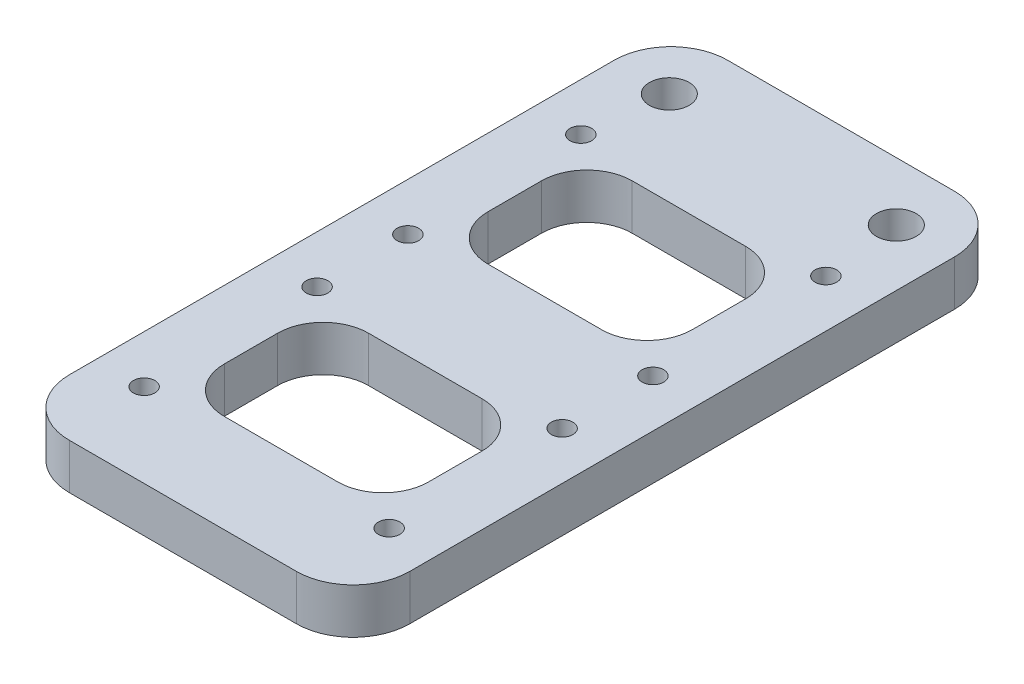
from build123d import *

# Parameters (mm, degrees)
SKETCH1_W           = 30
SKETCH1_H           = 30
BOSS_EXTRUDE1_DEPTH = 4
SKETCH3_W           = 30
SKETCH3_H           = 28
BOSS_EXTRUDE2_DEPTH = 4
SKETCH2_R           = 0.95
SKETCH2_R_2         = 1.75
CUT_EXTRUDE1_DEPTH  = 46.716517803
FILLET1_R           = 5


with BuildPart() as part:
    # Sketch1 → Boss-Extrude1 (new body)
    with BuildSketch(Plane(origin=(0, 0, 0), x_dir=(1, 0, 0), z_dir=(0, 1, 0))):
        Rectangle(SKETCH1_W, SKETCH1_H)
    extrude(amount=BOSS_EXTRUDE1_DEPTH)

    # Sketch3 → Boss-Extrude2 (add)
    with BuildSketch(Plane(origin=(0, 4, 0), x_dir=(1, 0, 0), z_dir=(0, 1, 0))):
        with Locations((0, 29)):
            Rectangle(SKETCH3_W, SKETCH3_H)
    extrude(amount=-BOSS_EXTRUDE2_DEPTH)

    # Sketch2 → Cut-Extrude1 (cut, through all)
    with BuildSketch(Plane(origin=(0, 4, 0), x_dir=(1, 0, 0), z_dir=(0, 1, 0))):
        with Locations(Location((-10.795, -7.62, 0), (0, 0, 270))):
            Circle(SKETCH2_R)
        with Locations(Location((10.795, -7.62, 0), (0, 0, 270))):
            Circle(SKETCH2_R)
        with Locations(Location((10.795, 7.62, 0), (0, 0, 270))):
            Circle(SKETCH2_R)
        with Locations(Location((-10.795, 7.62, 0), (0, 0, 270))):
            Circle(SKETCH2_R)
        with Locations(Location((-10.795, 30.86, 0), (0, 0, 270))):
            Circle(SKETCH2_R)
        with Locations(Location((10.795, 30.86, 0), (0, 0, 270))):
            Circle(SKETCH2_R)
        with Locations(Location((10.795, 15.62, 0), (0, 0, 270))):
            Circle(SKETCH2_R)
        with Locations(Location((-10.795, 15.62, 0), (0, 0, 270))):
            Circle(SKETCH2_R)
        with Locations(Location((-10, 37.86, 0), (0, 0, 270))):
            Circle(SKETCH2_R_2)
        with Locations(Location((10, 37.86, 0), (0, 0, 270))):
            Circle(SKETCH2_R_2)
        with BuildLine():
            Line((-5, -6.352941176), (5, -6.352941176))
            ThreePointArc((5, -6.352941176), (7.828427125, -5.181368301), (9, -2.352941176))
            Line((9, -2.352941176), (9, 2.352941176))
            ThreePointArc((9, 2.352941176), (7.828427125, 5.181368301), (5, 6.352941176))
            Line((5, 6.352941176), (-5, 6.352941176))
            ThreePointArc((-5, 6.352941176), (-7.828427125, 5.181368301), (-9, 2.352941176))
            Line((-9, 2.352941176), (-9, -2.352941176))
            ThreePointArc((-9, -2.352941176), (-7.828427125, -5.181368301), (-5, -6.352941176))
        make_face()
        with BuildLine():
            Line((-5, 16.887058824), (5, 16.887058824))
            ThreePointArc((5, 16.887058824), (7.828427125, 18.058631699), (9, 20.887058824))
            Line((9, 20.887058824), (9, 25.592941176))
            ThreePointArc((9, 25.592941176), (7.828427125, 28.421368301), (5, 29.592941176))
            Line((5, 29.592941176), (-5, 29.592941176))
            ThreePointArc((-5, 29.592941176), (-7.828427125, 28.421368301), (-9, 25.592941176))
            Line((-9, 25.592941176), (-9, 20.887058824))
            ThreePointArc((-9, 20.887058824), (-7.828427125, 18.058631699), (-5, 16.887058824))
        make_face()
    extrude(amount=-CUT_EXTRUDE1_DEPTH, mode=Mode.SUBTRACT)

    # Fillet1
    fillet1_edges = [part.edges().sort_by_distance(p)[0] for p in [
        (15, 2, -43),
        (-15, 2, -43),
        (15, 2, 15),
        (-15, 2, 15),
    ]]
    fillet(fillet1_edges, radius=FILLET1_R)


solid = part.part
